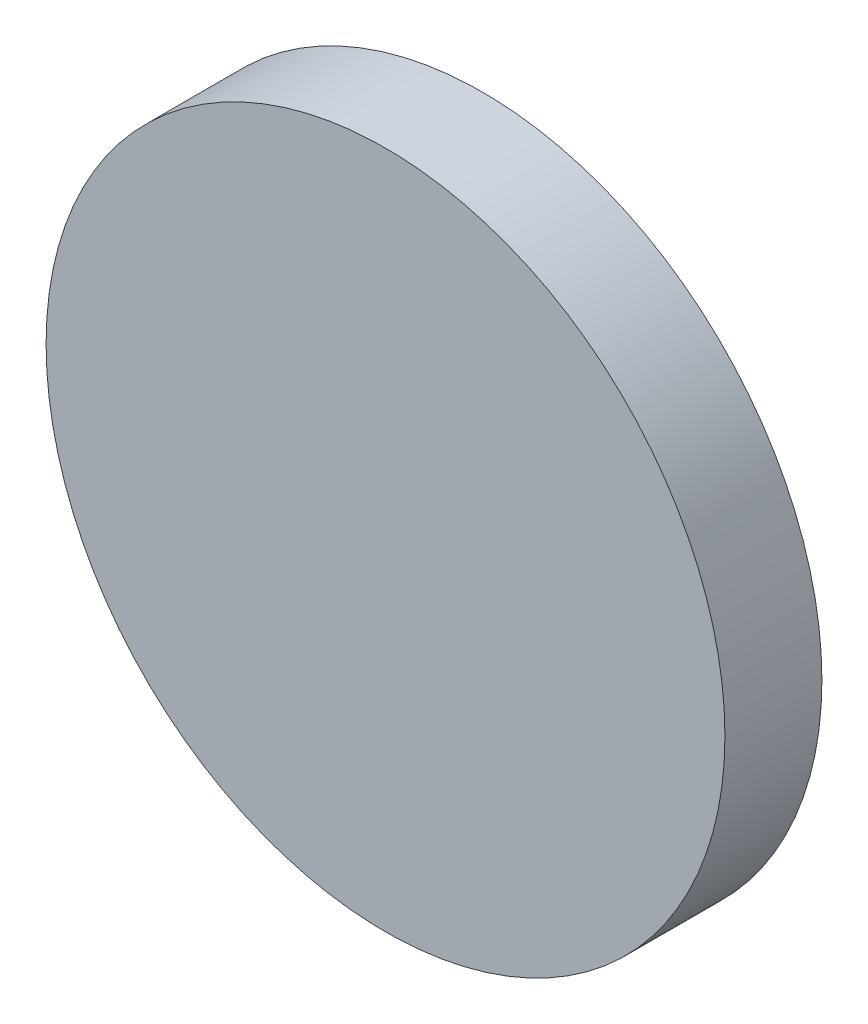
from build123d import *

# Parameters (mm, degrees)
SKETCH1_R           = 7
BOSS_EXTRUDE1_DEPTH = 2


with BuildPart() as part:
    # Sketch1 → Boss-Extrude1 (new body)
    with BuildSketch(Plane.XY):
        Circle(SKETCH1_R)
    extrude(amount=BOSS_EXTRUDE1_DEPTH)


solid = part.part
